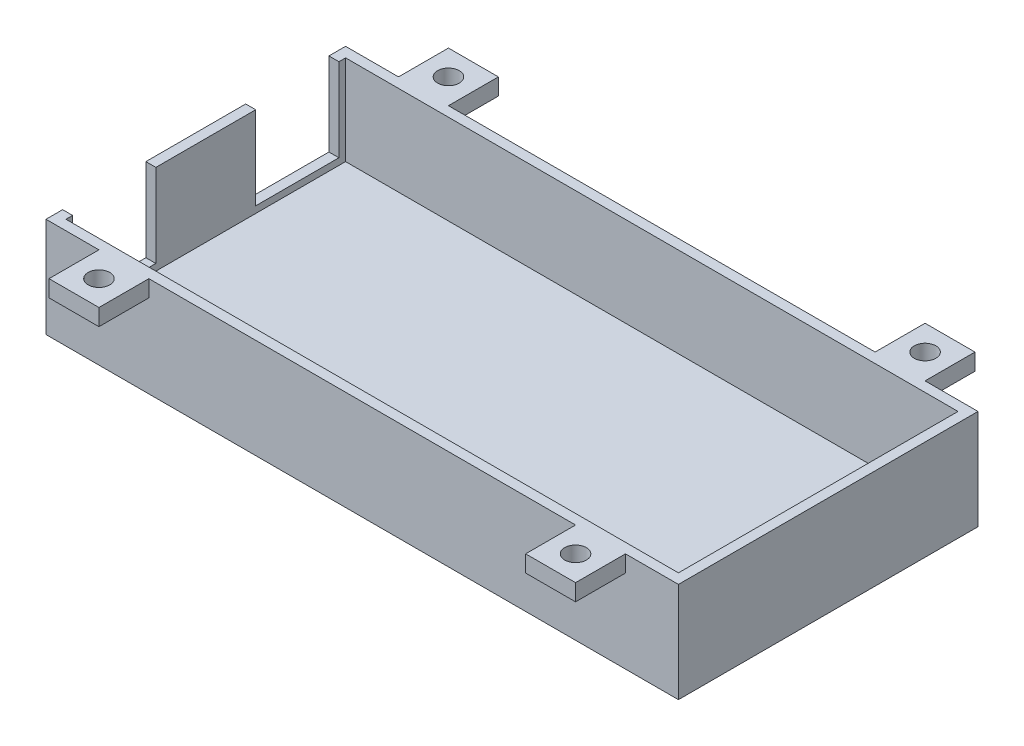
from build123d import *

# Parameters (mm, degrees)
SKETCH2_W           = 190
SKETCH2_H           = 90
BOSS_EXTRUDE1_DEPTH = 5
SKETCH3_W           = 190
SKETCH3_H           = 90
SKETCH3_W_2         = 180
SKETCH3_H_2         = 80
BOSS_EXTRUDE2_DEPTH = 25
SKETCH5_W           = 25
SKETCH5_H           = 25
CUT_EXTRUDE1_DEPTH  = 5
SKETCH6_W           = 15
SKETCH6_H           = 15
SKETCH6_R           = 3.25
BOSS_EXTRUDE3_DEPTH = 5
SKETCH8_W           = 184
SKETCH8_H           = 84
CUT_EXTRUDE2_DEPTH  = 27


with BuildPart() as part:
    # Sketch2 → Boss-Extrude1 (new body)
    with BuildSketch(Plane(origin=(0, 0, 0), x_dir=(1, 0, 0), z_dir=(0, 1, 0))):
        Rectangle(SKETCH2_W, SKETCH2_H)
    extrude(amount=BOSS_EXTRUDE1_DEPTH)

    # Sketch3 → Boss-Extrude2 (add)
    with BuildSketch(Plane(origin=(0, 5, 0), x_dir=(1, 0, 0), z_dir=(0, 1, 0))):
        Rectangle(SKETCH3_W, SKETCH3_H)
        Rectangle(SKETCH3_W_2, SKETCH3_H_2, mode=Mode.SUBTRACT)
    extrude(amount=BOSS_EXTRUDE2_DEPTH)

    # Sketch5 → Cut-Extrude1 (cut)
    with BuildSketch(Plane(origin=(-90, 0, 0), x_dir=(0, 0, -1), z_dir=(1, 0, 0))):
        with Locations((-27.5, 17.5)):
            Rectangle(SKETCH5_W, SKETCH5_H)
        with Locations((27.5, 17.5)):
            Rectangle(SKETCH5_W, SKETCH5_H)
    extrude(amount=-CUT_EXTRUDE1_DEPTH, mode=Mode.SUBTRACT)

    # Sketch6 → Boss-Extrude3 (add)
    # profile 1 of 4: a face of its own
    with BuildSketch(Plane(origin=(0, 30, 0), x_dir=(1, 0, 0), z_dir=(0, 1, 0))):
        with Locations((-71.593545043, 52.5)):
            Rectangle(SKETCH6_W, SKETCH6_H)
        with Locations(Location((-71.593545043, 52.5, 0), (0, 0, 270))):
            Circle(SKETCH6_R, mode=Mode.SUBTRACT)
    # profile 2 of 4: a face of its own
    with BuildSketch(Plane(origin=(0, 30, 0), x_dir=(1, 0, 0), z_dir=(0, 1, 0))):
        with Locations((-71.593545043, -52.5)):
            Rectangle(SKETCH6_W, SKETCH6_H)
        with Locations(Location((-71.593545043, -52.5, 0), (0, 0, 90))):
            Circle(SKETCH6_R, mode=Mode.SUBTRACT)
    # profile 3 of 4: a face of its own
    with BuildSketch(Plane(origin=(0, 30, 0), x_dir=(1, 0, 0), z_dir=(0, 1, 0))):
        with Locations((71.593545043, -52.5)):
            Rectangle(SKETCH6_W, SKETCH6_H)
        with Locations(Location((71.593545043, -52.5, 0), (0, 0, 270))):
            Circle(SKETCH6_R, mode=Mode.SUBTRACT)
    # profile 4 of 4: a face of its own
    with BuildSketch(Plane(origin=(0, 30, 0), x_dir=(1, 0, 0), z_dir=(0, 1, 0))):
        with Locations((71.593545043, 52.5)):
            Rectangle(SKETCH6_W, SKETCH6_H)
        with Locations(Location((71.593545043, 52.5, 0), (0, 0, 90))):
            Circle(SKETCH6_R, mode=Mode.SUBTRACT)
    extrude(amount=-BOSS_EXTRUDE3_DEPTH)

    # Sketch8 → Cut-Extrude2 (cut)
    with BuildSketch(Plane(origin=(0, 30, 0), x_dir=(1, 0, 0), z_dir=(0, 1, 0))):
        Rectangle(SKETCH8_W, SKETCH8_H)
    extrude(amount=-CUT_EXTRUDE2_DEPTH, mode=Mode.SUBTRACT)


solid = part.part
